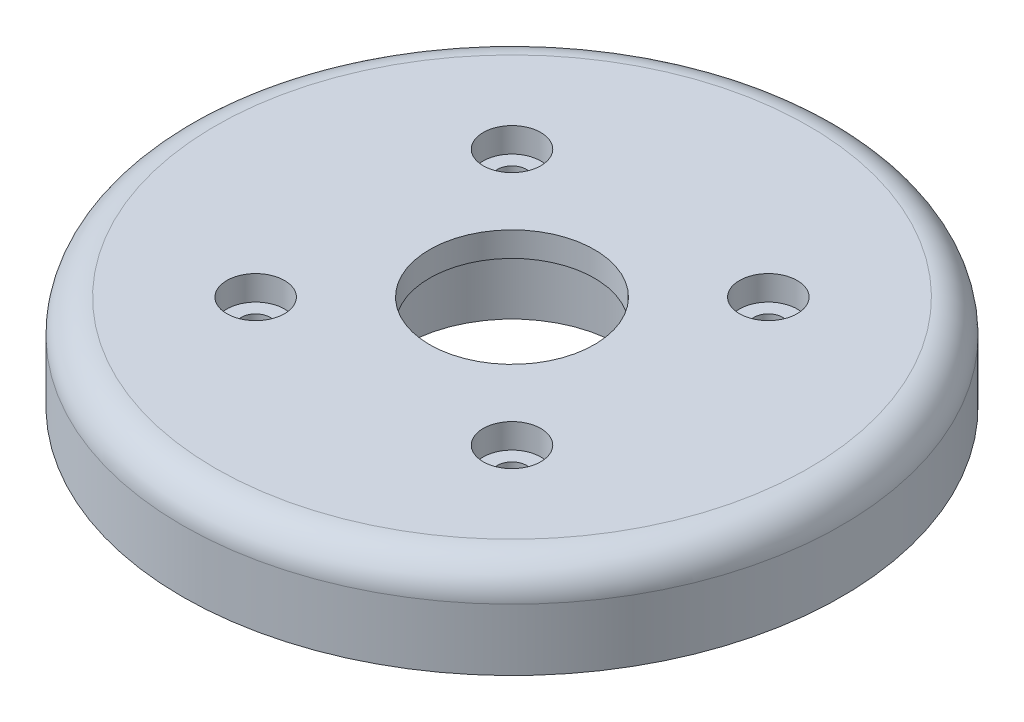
from build123d import *

# Parameters (mm, degrees)
SKETCH1_R           = 40
SKETCH1_R_2         = 13
BOSS_EXTRUDE1_DEPTH = 8.5
SKETCH3_R           = 1.75
CUT_EXTRUDE1_DEPTH  = 58.203583804
SKETCH2_R           = 40
SKETCH2_R_2         = 10
SKETCH2_R_3         = 3.5
BOSS_EXTRUDE2_DEPTH = 3
FILLET1_R           = 4


with BuildPart() as part:
    # Sketch1 → Boss-Extrude1 (new body)
    with BuildSketch(Plane(origin=(0, 0, 0), x_dir=(1, 0, 0), z_dir=(0, 1, 0))):
        with Locations(Location((0, 0, 0), (0, 0, 270))):
            Circle(SKETCH1_R)
        with Locations(Location((0, 0, 0), (0, 0, 270))):
            Circle(SKETCH1_R_2, mode=Mode.SUBTRACT)
    extrude(amount=BOSS_EXTRUDE1_DEPTH)

    # Sketch3 → Cut-Extrude1 (cut, through all)
    with BuildSketch(Plane(origin=(0, 8.5, 0), x_dir=(1, 0, 0), z_dir=(0, 1, 0))):
        with Locations(Location((-15.556349186, 15.556349186, 0), (0, 0, 270))):
            Circle(SKETCH3_R)
        with Locations(Location((15.556349186, 15.556349186, 0), (0, 0, 270))):
            Circle(SKETCH3_R)
        with Locations(Location((15.556349186, -15.556349186, 0), (0, 0, 270))):
            Circle(SKETCH3_R)
        with Locations(Location((-15.556349186, -15.556349186, 0), (0, 0, 270))):
            Circle(SKETCH3_R)
    extrude(amount=-CUT_EXTRUDE1_DEPTH, mode=Mode.SUBTRACT)

    # Sketch2 → Boss-Extrude2 (add)
    with BuildSketch(Plane(origin=(0, 8.5, 0), x_dir=(1, 0, 0), z_dir=(0, 1, 0))):
        with Locations(Location((0, 0, 0), (0, 0, 270))):
            Circle(SKETCH2_R)
        with Locations(Location((0, 0, 0), (0, 0, 270))):
            Circle(SKETCH2_R_2, mode=Mode.SUBTRACT)
        with Locations(Location((-15.556349186, 15.556349186, 0), (0, 0, 270))):
            Circle(SKETCH2_R_3, mode=Mode.SUBTRACT)
        with Locations(Location((15.556349186, 15.556349186, 0), (0, 0, 270))):
            Circle(SKETCH2_R_3, mode=Mode.SUBTRACT)
        with Locations(Location((15.556349186, -15.556349186, 0), (0, 0, 270))):
            Circle(SKETCH2_R_3, mode=Mode.SUBTRACT)
        with Locations(Location((-15.556349186, -15.556349186, 0), (0, 0, 270))):
            Circle(SKETCH2_R_3, mode=Mode.SUBTRACT)
    extrude(amount=BOSS_EXTRUDE2_DEPTH)

    # Fillet1
    fillet1_edges = [part.edges().sort_by_distance(p)[0] for p in [
        (0, 11.5, -40),
    ]]
    fillet(fillet1_edges, radius=FILLET1_R)


solid = part.part
